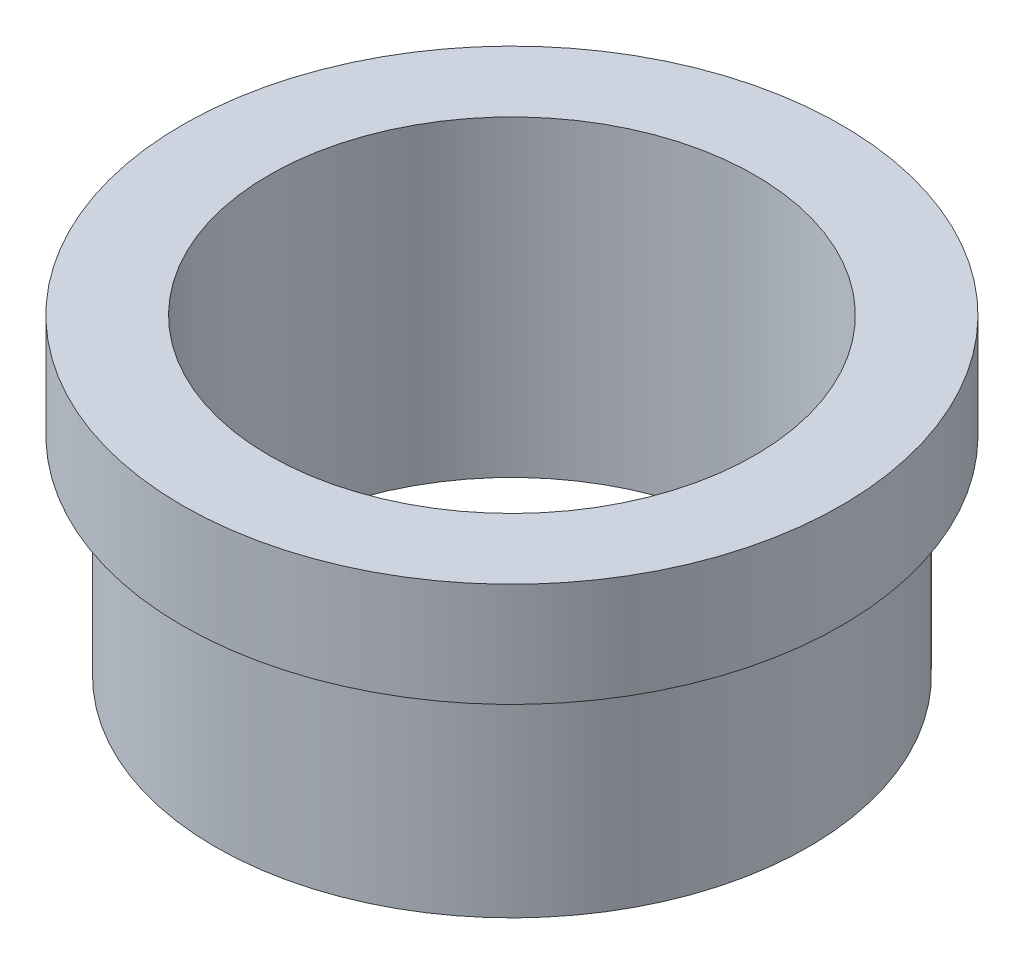
from build123d import *

# Parameters (mm, degrees)
SKETCH1_R           = 8.55
SKETCH1_R_2         = 7
BOSS_EXTRUDE1_DEPTH = 6
SKETCH2_R           = 9.5
SKETCH2_R_2         = 7
BOSS_EXTRUDE2_DEPTH = 3


with BuildPart() as part:
    # Sketch1 → Boss-Extrude1 (new body)
    with BuildSketch(Plane(origin=(0, 0, 0), x_dir=(1, 0, 0), z_dir=(0, 1, 0))):
        with Locations(Location((0, 0, 0), (0, 0, 270))):
            Circle(SKETCH1_R)
        with Locations(Location((0, 0, 0), (0, 0, 270))):
            Circle(SKETCH1_R_2, mode=Mode.SUBTRACT)
    extrude(amount=BOSS_EXTRUDE1_DEPTH)

    # Sketch2 → Boss-Extrude2 (add)
    with BuildSketch(Plane(origin=(0, 6, 0), x_dir=(1, 0, 0), z_dir=(0, 1, 0))):
        with Locations(Location((0, 0, 0), (0, 0, 270))):
            Circle(SKETCH2_R)
        with Locations(Location((0, 0, 0), (0, 0, 270))):
            Circle(SKETCH2_R_2, mode=Mode.SUBTRACT)
    extrude(amount=BOSS_EXTRUDE2_DEPTH)


solid = part.part
